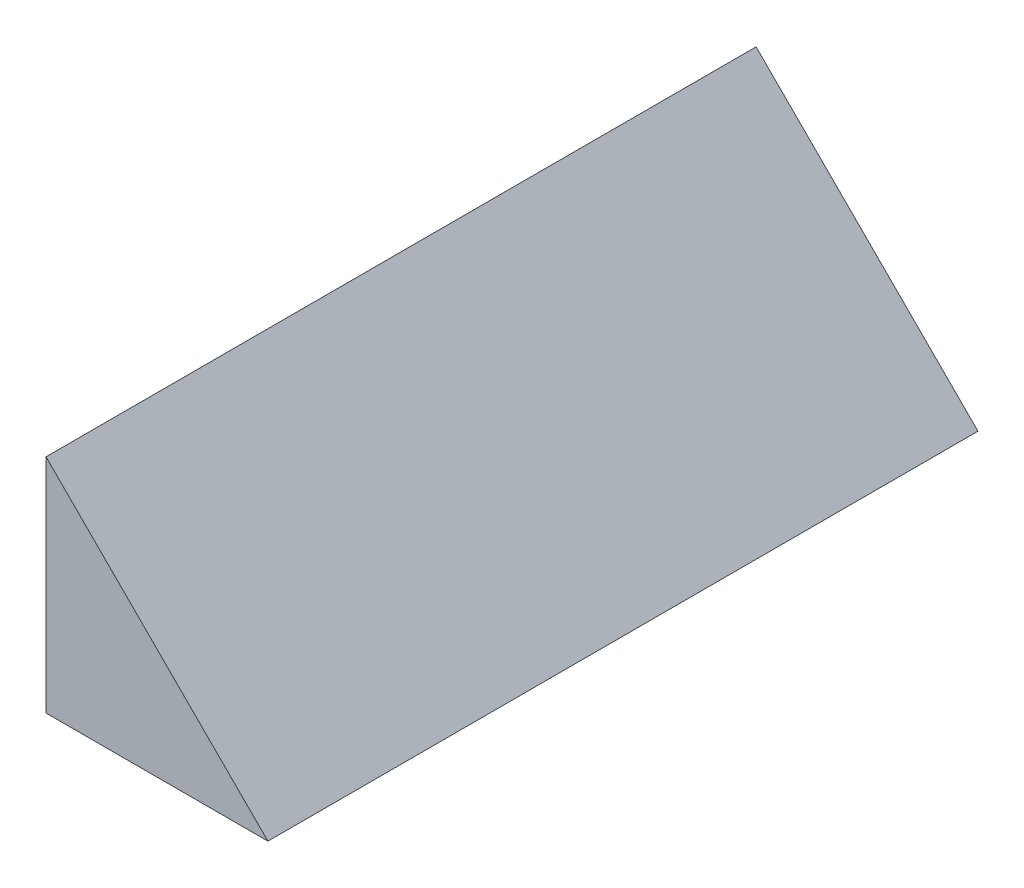
from build123d import *

# Parameters (mm, degrees)
BOSS_EXTRUDE1_DEPTH = 0.8


with BuildPart() as part:
    # Sketch1 → Boss-Extrude1 (new body)
    with BuildSketch(Plane.XY):
        Polygon((0, 0), (0, 0.25), (0.25, 0), align=None)
    extrude(amount=BOSS_EXTRUDE1_DEPTH)


solid = part.part
